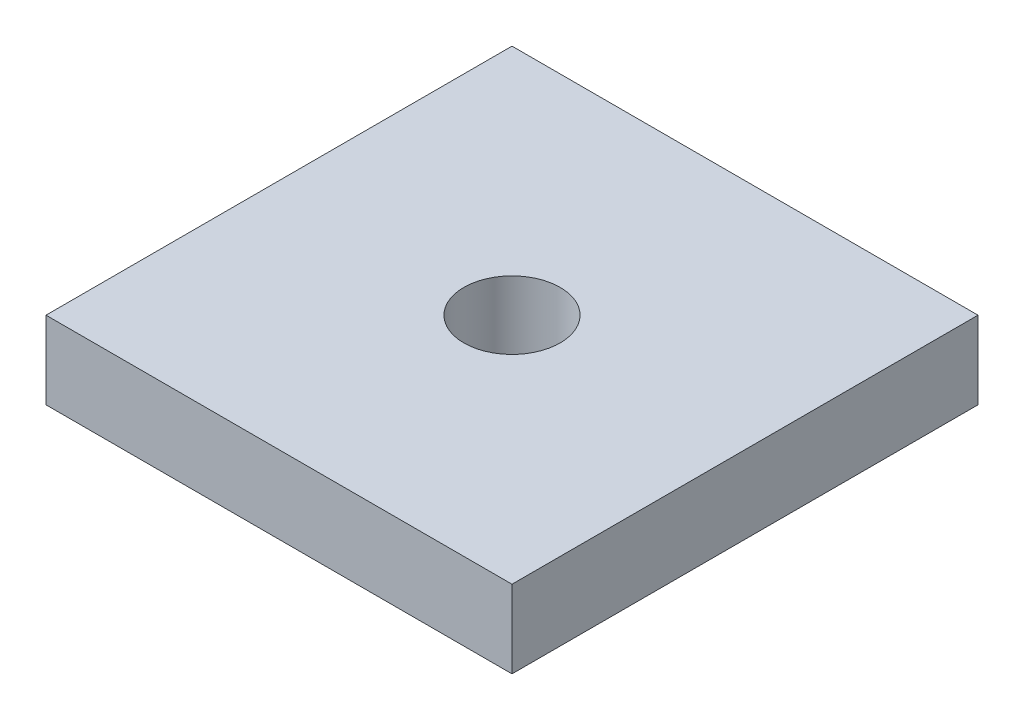
from build123d import *

# Parameters (mm, degrees)
SKETCH1_W           = 30
SKETCH1_H           = 30
SKETCH1_R           = 3.1
BOSS_EXTRUDE1_DEPTH = 5


with BuildPart() as part:
    # Sketch1 → Boss-Extrude1 (new body)
    with BuildSketch(Plane(origin=(0, 0, 0), x_dir=(1, 0, 0), z_dir=(0, 1, 0))):
        Rectangle(SKETCH1_W, SKETCH1_H)
        with Locations(Location((0, 0, 0), (0, 0, 270))):
            Circle(SKETCH1_R, mode=Mode.SUBTRACT)
    extrude(amount=BOSS_EXTRUDE1_DEPTH)


solid = part.part
